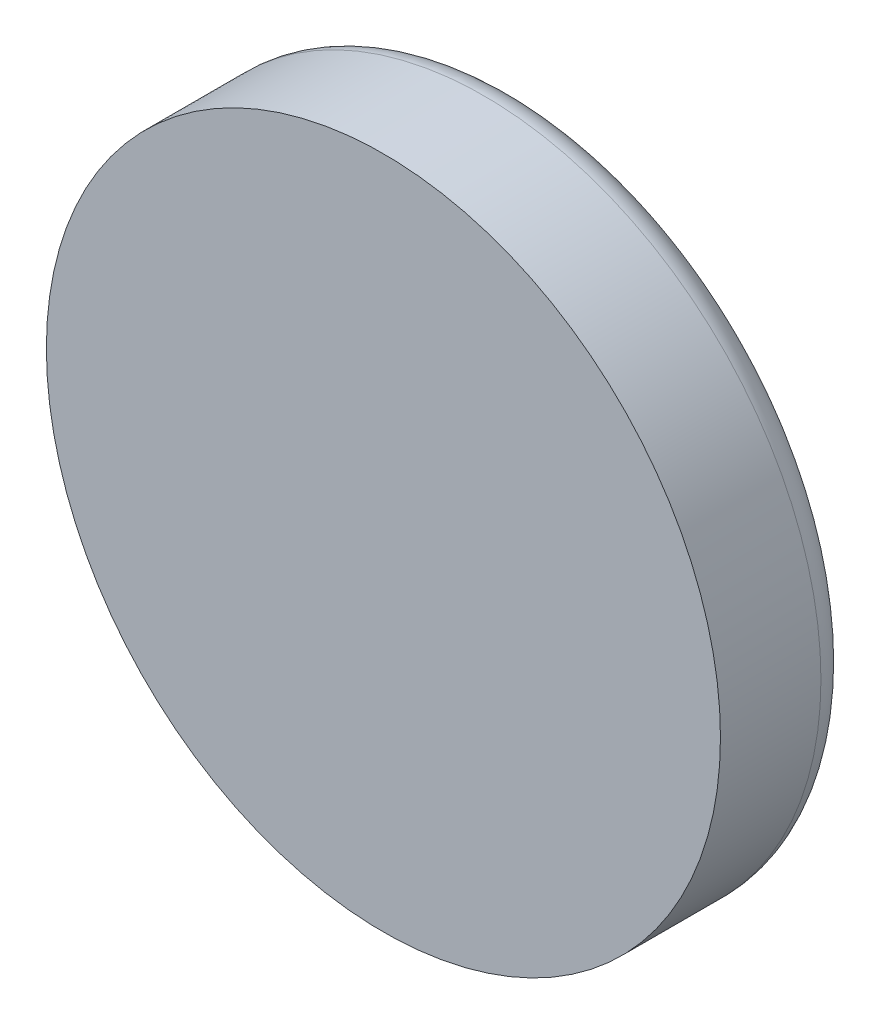
from build123d import *


with BuildPart() as part:
    # Sketch2 → Revolve1 (revolve)
    with BuildSketch(Plane(origin=(0, 33.3375, 0), x_dir=(1, 0, 0), z_dir=(0, 1, 0)), mode=Mode.PRIVATE) as revolve1_sk:
        with BuildLine():
            Line((98.55612652, 25.4), (98.55612652, 34.925))
            ThreePointArc((98.55612652, 34.925), (90.275502713, 34.101604977), (82.194241044, 32.116681842))
            ThreePointArc((82.194241044, 32.116681842), (81.397949419, 31.540361745), (81.09362652, 30.605689194))
            Line((81.09362652, 30.605689194), (81.09362652, 25.4))
            Line((81.09362652, 25.4), (98.55612652, 25.4))
        make_face()
    revolve(revolve1_sk.sketch.rotate(Axis((98.55612652, 33.3375, -25.4), (0, 0, -1)), 180), axis=Axis((98.55612652, 33.3375, -25.4), (0, 0, -1)))


solid = part.part
